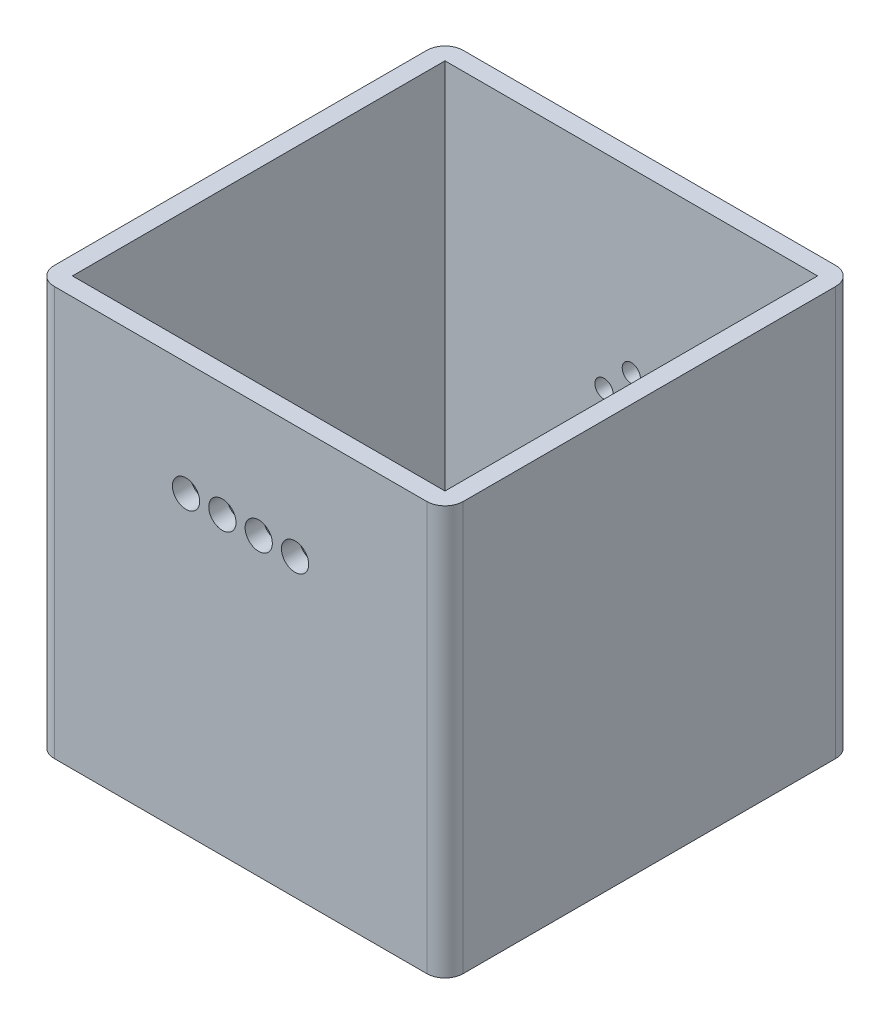
from build123d import *

# Parameters (mm, degrees)
BOSS_EXTRUDE2_DEPTH      = 22.5
BOSS_EXTRUDE2_DEPTH_BACK = 22.5
SKETCH4_W                = 45
SKETCH4_H                = 45
CUT_EXTRUDE1_DEPTH       = 22.5
CUT_EXTRUDE1_DEPTH_BACK  = 20.5
SKETCH5_W                = 41
SKETCH5_H                = 41
SKETCH6_R                = 1.5
CUT_EXTRUDE2_DEPTH       = 32.5
SKETCH8_R                = 1
CUT_EXTRUDE3_DEPTH       = 32.5
SKETCH9_W                = 7.5
SKETCH9_H                = 3.5
CUT_EXTRUDE4_DEPTH       = 32.5
FILLET2_R                = 1
FILLET3_R                = 2


with BuildPart() as part:
    # Sketch4 → Boss-Extrude2 (new, two sides: drawn at the far end of the back side and taken through both)
    with BuildSketch(Plane(origin=(0, 0, 0), x_dir=(1, 0, 0), z_dir=(0, 1, 0)).offset(-BOSS_EXTRUDE2_DEPTH_BACK)):
        Rectangle(SKETCH4_W, SKETCH4_H)
    extrude(amount=BOSS_EXTRUDE2_DEPTH + BOSS_EXTRUDE2_DEPTH_BACK)

    # Sketch5 → Cut-Extrude1 (cut, two sides: drawn at the far end of the back side and taken through both)
    with BuildSketch(Plane(origin=(0, 0, 0), x_dir=(1, 0, 0), z_dir=(0, 1, 0)).offset(-CUT_EXTRUDE1_DEPTH_BACK)):
        Rectangle(SKETCH5_W, SKETCH5_H)
    extrude(amount=CUT_EXTRUDE1_DEPTH + CUT_EXTRUDE1_DEPTH_BACK, mode=Mode.SUBTRACT)

    # Sketch6 → Cut-Extrude2 (cut)
    with BuildSketch(Plane.XY):
        with Locations((2, 10)):
            Circle(SKETCH6_R)
        with Locations((6, 10)):
            Circle(SKETCH6_R)
        with Locations((-2, 10)):
            Circle(SKETCH6_R)
        with Locations((-6, 10)):
            Circle(SKETCH6_R)
    extrude(amount=CUT_EXTRUDE2_DEPTH, mode=Mode.SUBTRACT)

    # Sketch8 → Cut-Extrude3 (cut)
    with BuildSketch(Plane.XY):
        Circle(SKETCH8_R)
        with Locations((3, 0)):
            Circle(SKETCH8_R)
        with Locations((0, 3)):
            Circle(SKETCH8_R)
        with Locations((-3, 0)):
            Circle(SKETCH8_R)
        with Locations((0, -3)):
            Circle(SKETCH8_R)
    extrude(amount=-CUT_EXTRUDE3_DEPTH, mode=Mode.SUBTRACT)

    # Sketch9 → Cut-Extrude4 (cut)
    with BuildSketch(Plane.XY):
        with Locations((0, -14.75)):
            Rectangle(SKETCH9_W, SKETCH9_H)
    extrude(amount=-CUT_EXTRUDE4_DEPTH, mode=Mode.SUBTRACT)

    # Fillet2
    fillet2_edges = [part.edges().sort_by_distance(p)[0] for p in [
        (-3.75, -16.5, -21.5),
        (3.75, -16.5, -21.5),
        (-3.75, -13, -21.5),
        (3.75, -13, -21.5),
    ]]
    fillet(fillet2_edges, radius=FILLET2_R)

    # Fillet3
    fillet3_edges = [part.edges().sort_by_distance(p)[0] for p in [
        (-22.5, 0, 22.5),
        (22.5, 0, -22.5),
        (22.5, 0, 22.5),
        (-22.5, 0, -22.5),
    ]]
    fillet(fillet3_edges, radius=FILLET3_R)


solid = part.part
